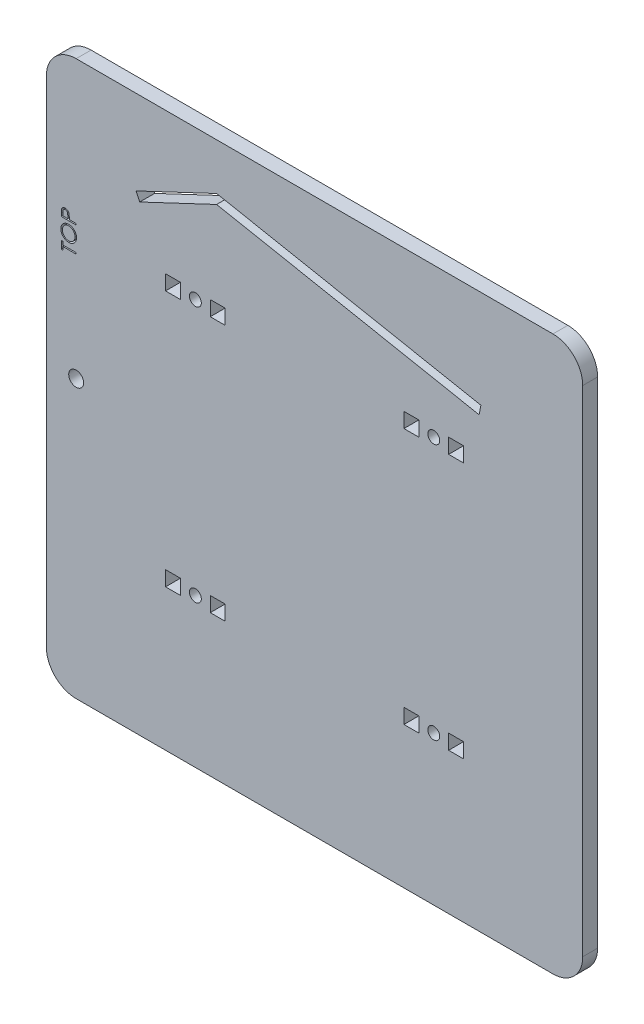
from build123d import *

# Parameters (mm, degrees)
ESQUISSE1_W             = 180
ESQUISSE1_H             = 186
ESQUISSE1_R             = 2.5
ESQUISSE1_R_2           = 2
ESQUISSE1_W_2           = 5
ESQUISSE1_H_2           = 5
BOSS_EXTRU_1_DEPTH      = 5
CONG_1_R                = 10
ENL_V_MAT_EXTRU_1_DEPTH = 259.884143972


with BuildPart() as part:
    # Esquisse1 → Boss.-Extru.1 (new body)
    with BuildSketch(Plane.XY):
        with Locations((90, 93)):
            Rectangle(ESQUISSE1_W, ESQUISSE1_H)
        with Locations((10, 93)):
            Circle(ESQUISSE1_R, mode=Mode.SUBTRACT)
        with Locations((50, 50)):
            Circle(ESQUISSE1_R_2, mode=Mode.SUBTRACT)
        with Locations((50, 136)):
            Circle(ESQUISSE1_R_2, mode=Mode.SUBTRACT)
        with Locations((130, 136)):
            Circle(ESQUISSE1_R_2, mode=Mode.SUBTRACT)
        with Locations((130, 50)):
            Circle(ESQUISSE1_R_2, mode=Mode.SUBTRACT)
        with Locations((42.5, 50)):
            Rectangle(ESQUISSE1_W_2, ESQUISSE1_H_2, mode=Mode.SUBTRACT)
        with Locations((57.5, 50)):
            Rectangle(ESQUISSE1_W_2, ESQUISSE1_H_2, mode=Mode.SUBTRACT)
        with Locations((42.5, 136)):
            Rectangle(ESQUISSE1_W_2, ESQUISSE1_H_2, mode=Mode.SUBTRACT)
        with Locations((57.5, 136)):
            Rectangle(ESQUISSE1_W_2, ESQUISSE1_H_2, mode=Mode.SUBTRACT)
        with Locations((122.5, 136)):
            Rectangle(ESQUISSE1_W_2, ESQUISSE1_H_2, mode=Mode.SUBTRACT)
        with Locations((137.5, 136)):
            Rectangle(ESQUISSE1_W_2, ESQUISSE1_H_2, mode=Mode.SUBTRACT)
        with Locations((122.5, 50)):
            Rectangle(ESQUISSE1_W_2, ESQUISSE1_H_2, mode=Mode.SUBTRACT)
        with Locations((137.5, 50)):
            Rectangle(ESQUISSE1_W_2, ESQUISSE1_H_2, mode=Mode.SUBTRACT)
    extrude(amount=BOSS_EXTRU_1_DEPTH)

    # Congé1
    cong_1_edges = [part.edges().sort_by_distance(p)[0] for p in [
        (0, 0, 2.5),
        (0, 186, 2.5),
        (180, 186, 2.5),
        (180, 0, 2.5),
    ]]
    fillet(cong_1_edges, radius=CONG_1_R)

    # Esquisse2 → Enlèv. mat.-Extru.1 (cut, through all)
    # profile 1 of 4: a face of its own
    with BuildSketch(Plane.XY.offset(5)):
        Polygon((31.334710719, 155.014027844), (57.1419993, 167.198026613), (145.226939688, 150.119771236), (145.821257498, 153.185098913), (57.1419993, 170.37858297), (30.10681248, 157.614875464), align=None)
    # profile 2 of 4: a face of its own
    with BuildSketch(Plane.XY.offset(5)):
        Polygon((5.512820513, 128.08974359), (5, 128.08974359), (5, 130.717948718), (5.512820513, 130.717948718), (5.512820513, 129.628205128), (10, 129.628205128), (10, 129.179487179), (5.512820513, 129.179487179), align=None)
    # profile 3 of 4: a face of its own
    with BuildSketch(Plane.XY.offset(5)):
        with BuildLine():
            add(Edge.make_bspline(
                [(4.871794872, 133.955128205), (4.874100366, 134.047721308), (4.878628546, 134.229581801), (4.914435384, 134.496612547), (4.973369693, 134.75230646), (5.056597521, 134.996810534), (5.164491941, 135.229194861), (5.295552763, 135.450115756), (5.450576468, 135.65891114), (5.627286682, 135.854143791), (5.820813205, 136.032241199), (6.027987018, 136.188522598), (6.2462034, 136.320360707), (6.475473732, 136.428284559), (6.715262732, 136.513011935), (6.966914295, 136.5714636), (7.228780179, 136.608804938), (7.407390098, 136.61317018), (7.497996795, 136.615384615)],
                knots=[0, 0, 0, 0, 1.065064174, 2.09187391, 3.093564831, 4.079973196, 5.057907931, 6.036227367, 7.030399151, 8.044883615, 9.061699972, 10.052012555, 11.025713132, 11.989727027, 12.962874294, 13.945865945, 14.957962116, 16, 16, 16, 16], degree=3))
            add(Edge.make_bspline(
                [(7.497996795, 136.615384615), (7.587935538, 136.613169435), (7.765215219, 136.608803057), (8.025426824, 136.571433302), (8.27553185, 136.512751121), (8.514972844, 136.429333599), (8.743777519, 136.321326931), (8.962159098, 136.189294737), (9.169886274, 136.033309942), (9.364746036, 135.855968827), (9.542997604, 135.662073634), (9.700222429, 135.455696049), (9.832117929, 135.237485486), (9.941246652, 135.00970325), (10.024208322, 134.770560724), (10.084607157, 134.52179815), (10.121577801, 134.262060189), (10.125971778, 134.085124404), (10.128205128, 133.995192308)],
                knots=[0, 0, 0, 0, 1.043748596, 2.057349401, 3.045489418, 4.02252776, 4.995289225, 5.97782527, 6.980224157, 8.006516136, 9.032559198, 10.034193337, 11.013412982, 11.987833483, 12.961212594, 13.946489799, 14.956251404, 16, 16, 16, 16], degree=3))
            add(Edge.make_bspline(
                [(10.128205128, 133.995192308), (10.125991718, 133.904586138), (10.121628499, 133.725977258), (10.084226492, 133.463781493), (10.025738915, 133.211956145), (9.942154006, 132.971221357), (9.834129391, 132.741442886), (9.702408849, 132.52217134), (9.546112933, 132.314286844), (9.368732112, 132.11951292), (9.175629895, 131.94129978), (8.968723816, 131.785929243), (8.752073164, 131.654179081), (8.525076701, 131.546517178), (8.288831783, 131.461282236), (8.041762529, 131.403132495), (7.785277521, 131.365509707), (7.610644809, 131.361174212), (7.522035256, 131.358974359)],
                knots=[0, 0, 0, 0, 1.053102029, 2.075944431, 3.073151272, 4.055350789, 5.033113405, 6.020478099, 7.024410459, 8.052272461, 9.079885166, 10.07527673, 11.055994387, 12.023226415, 12.992069828, 13.970394897, 14.97016774, 16, 16, 16, 16], degree=3))
            add(Edge.make_bspline(
                [(7.522035256, 131.358974359), (7.462560015, 131.359738124), (7.344359838, 131.361256019), (7.168836124, 131.379529865), (6.996135184, 131.406046581), (6.826748116, 131.444049313), (6.661089566, 131.493751695), (6.498017048, 131.552397448), (6.339183157, 131.624025799), (6.183835454, 131.704998153), (6.034395589, 131.795372165), (5.893139041, 131.895194664), (5.758880475, 132.000959476), (5.635099041, 132.116907181), (5.518193817, 132.239216388), (5.409961364, 132.369871214), (5.30942572, 132.508074421), (5.218825233, 132.654420677), (5.136883612, 132.805303927), (5.066566682, 132.960842181), (5.006215165, 133.118922998), (4.957299701, 133.28028678), (4.918682507, 133.444505026), (4.892386287, 133.611936147), (4.874065833, 133.782446756), (4.872555116, 133.897320069), (4.871794872, 133.955128205)],
                knots=[0, 0, 0, 0, 1.037015668, 2.060948919, 3.074880161, 4.083647147, 5.086022904, 6.090072063, 7.104153813, 8.122640571, 9.144368836, 10.147691507, 11.138137339, 12.123020368, 13.103399296, 14.087645067, 15.080126199, 16.082011238, 17.087798457, 18.072939717, 19.057185487, 20.037253025, 21.01195951, 21.997135196, 22.992090687, 24, 24, 24, 24], degree=3))
        make_face()
        with BuildLine():
            add(Edge.make_bspline(
                [(5.384615385, 133.977163462), (5.385191782, 133.929713378), (5.386339066, 133.835266838), (5.4015342, 133.694869329), (5.423036024, 133.556275643), (5.454264212, 133.419753979), (5.494656516, 133.285018024), (5.543372824, 133.15200796), (5.602253781, 133.021179837), (5.668472573, 132.892697094), (5.743686527, 132.769527262), (5.823556399, 132.651373713), (5.91104979, 132.541309721), (6.004274519, 132.437823315), (6.104039635, 132.341171855), (6.209689967, 132.251397972), (6.321682483, 132.168575286), (6.439556284, 132.093700531), (6.562653257, 132.027067843), (6.688620316, 131.967408805), (6.818937839, 131.917953738), (6.952792603, 131.878777957), (7.089594741, 131.845526695), (7.2300896, 131.824669043), (7.373792844, 131.80932419), (7.470910332, 131.808240457), (7.520032051, 131.807692308)],
                knots=[0, 0, 0, 0, 1.008406545, 2.007172654, 2.999155034, 3.989332444, 4.982025741, 5.988181096, 6.998684226, 8.030553839, 9.059268815, 10.065399129, 11.060956322, 12.046057109, 13.024974577, 14.012068307, 14.991706172, 15.984221787, 16.978487447, 17.966117052, 18.945677757, 19.938371053, 20.93015022, 21.936155317, 22.956113857, 24, 24, 24, 24], degree=3))
            add(Edge.make_bspline(
                [(7.520032051, 131.807692308), (7.592262153, 131.809517706), (7.734361108, 131.813108829), (7.942624745, 131.844417334), (8.142969779, 131.893026882), (8.334202078, 131.963501544), (8.517174398, 132.053405882), (8.691174677, 132.163070921), (8.856151586, 132.293500964), (9.010877038, 132.441570897), (9.152044866, 132.603481466), (9.276132129, 132.775324258), (9.38056743, 132.955739717), (9.467872995, 133.143687975), (9.533645375, 133.340773702), (9.580541052, 133.54573326), (9.610935473, 133.75857118), (9.613887494, 133.903607886), (9.615384615, 133.977163462)],
                knots=[0, 0, 0, 0, 1.032022337, 2.030307203, 3.003823408, 3.974715386, 4.937372378, 5.913284036, 6.909147208, 7.938749767, 8.970518239, 9.975863271, 10.963918693, 11.946286286, 12.933361397, 13.927862637, 14.949112547, 16, 16, 16, 16], degree=3))
            add(Edge.make_bspline(
                [(9.615384615, 133.977163462), (9.614705871, 134.026605801), (9.613359718, 134.124664811), (9.599782149, 134.270512706), (9.578052476, 134.413746565), (9.546611683, 134.554101743), (9.507782619, 134.691762134), (9.459619166, 134.826312368), (9.401882729, 134.957707756), (9.337537382, 135.086594397), (9.264442801, 135.210086396), (9.185649647, 135.327523252), (9.099700046, 135.437397621), (9.007727364, 135.540835473), (8.908268925, 135.63680957), (8.803260669, 135.726327848), (8.691030462, 135.807718507), (8.573639443, 135.882339435), (8.451439922, 135.949785143), (8.325126552, 136.007718527), (8.195376793, 136.057194836), (8.062095316, 136.097078346), (7.925581926, 136.128347168), (7.785641242, 136.149888858), (7.642556621, 136.16495834), (7.545779663, 136.166094126), (7.496995192, 136.166666667)],
                knots=[0, 0, 0, 0, 1.047334373, 2.07717862, 3.100662057, 4.115010574, 5.122652213, 6.129548646, 7.140165612, 8.16200981, 9.179904151, 10.178566626, 11.156366481, 12.133321541, 13.108841334, 14.082538371, 15.054589433, 16.043660176, 17.028268541, 18.009491307, 18.985652105, 19.968123554, 20.954864208, 21.950389976, 22.966808393, 24, 24, 24, 24], degree=3))
            add(Edge.make_bspline(
                [(7.496995192, 136.166666667), (7.448544472, 136.166093648), (7.352433543, 136.16495696), (7.21034666, 136.149896282), (7.0714135, 136.128323582), (6.936179497, 136.097233999), (6.804610173, 136.057162352), (6.676829113, 136.007751874), (6.552360233, 135.949487181), (6.43151135, 135.882618212), (6.315547019, 135.807453036), (6.204687986, 135.725317342), (6.101006831, 135.634799377), (6.001978999, 135.538461671), (5.909585252, 135.433988056), (5.824182583, 135.3213603), (5.741923034, 135.203382687), (5.669122422, 135.077387241), (5.601554572, 134.947821857), (5.543908824, 134.81475094), (5.494399292, 134.680074937), (5.454143633, 134.543255388), (5.423155643, 134.404356965), (5.401514958, 134.263460443), (5.386344285, 134.121057631), (5.385193514, 134.025280393), (5.384615385, 133.977163462)],
                knots=[0, 0, 0, 0, 1.029877221, 2.042951179, 3.035109885, 4.018542222, 4.991021277, 5.957494829, 6.929429462, 7.911425532, 8.892163142, 9.866273635, 10.842761649, 11.81676864, 12.802607151, 13.805177466, 14.821356543, 15.858816981, 16.897175917, 17.927346774, 18.940346092, 19.946830556, 20.957962087, 21.964146003, 22.97721996, 24, 24, 24, 24], degree=3))
        make_face(mode=Mode.SUBTRACT)
    # profile 4 of 4: a face of its own
    with BuildSketch(Plane.XY.offset(5)):
        with BuildLine():
            Line((5, 137.641025641), (5, 138.621594551))
            add(Edge.make_bspline(
                [(5, 138.621594551), (5.000074137, 138.689038703), (5.000216188, 138.818264693), (5.004522968, 139.003571915), (5.010275385, 139.171871532), (5.018249518, 139.322800647), (5.027673219, 139.456823645), (5.040890418, 139.573334073), (5.05469084, 139.673247724), (5.068721421, 139.733114081), (5.075120192, 139.760416667)],
                knots=[0, 0, 0, 0, 1.415646017, 2.712440637, 3.8905458, 4.950247383, 5.884950622, 6.709939814, 7.411656543, 8, 8, 8, 8], degree=3))
            add(Edge.make_bspline(
                [(5.075120192, 139.760416667), (5.084580491, 139.794978556), (5.103278168, 139.863287928), (5.140720988, 139.961722351), (5.185143963, 140.05535451), (5.235676091, 140.14460231), (5.294804796, 140.227840245), (5.358596495, 140.307843096), (5.431173681, 140.38178677), (5.510247246, 140.450672822), (5.594814292, 140.514342289), (5.686411295, 140.567836154), (5.782303587, 140.614609524), (5.883794422, 140.652905255), (5.990982335, 140.681383552), (6.103105582, 140.702525818), (6.220290239, 140.716006907), (6.300376841, 140.717293675), (6.341145833, 140.717948718)],
                knots=[0, 0, 0, 0, 0.999549623, 1.97554611, 2.93413192, 3.889860808, 4.833293765, 5.780583482, 6.742559327, 7.719844669, 8.705620613, 9.691528643, 10.674968152, 11.680406189, 12.713313868, 13.765869198, 14.862690416, 16, 16, 16, 16], degree=3))
            add(Edge.make_bspline(
                [(6.341145833, 140.717948718), (6.382256943, 140.717346683), (6.462693606, 140.71616876), (6.580369018, 140.702031209), (6.692823861, 140.682988078), (6.79980879, 140.653706575), (6.900688462, 140.615355614), (6.997004508, 140.570366967), (7.087118325, 140.51610478), (7.171357064, 140.453755024), (7.249799796, 140.384395603), (7.321878074, 140.308319977), (7.387169986, 140.225835274), (7.445821905, 140.137203634), (7.496473733, 140.041560992), (7.541841312, 139.940357916), (7.579942827, 139.832714749), (7.599985772, 139.758225444), (7.610176282, 139.720352564)],
                knots=[0, 0, 0, 0, 1.121902311, 2.195077645, 3.232258892, 4.234102512, 5.217864754, 6.176164875, 7.132989551, 8.084763148, 9.034132444, 9.988522005, 10.94243251, 11.903244335, 12.886203696, 13.894208494, 14.929344452, 16, 16, 16, 16], degree=3))
            add(Edge.make_bspline(
                [(7.610176282, 139.720352564), (7.616832719, 139.689027445), (7.631420688, 139.620376624), (7.647817156, 139.507322681), (7.661264052, 139.375627506), (7.673812802, 139.225739185), (7.680462071, 139.05730818), (7.688269398, 138.870720793), (7.691953248, 138.665345548), (7.692186114, 138.522102718), (7.692307692, 138.447315705)],
                knots=[0, 0, 0, 0, 0.601372724, 1.317943291, 2.144091499, 3.08771165, 4.142394186, 5.309582461, 6.595334295, 8, 8, 8, 8], degree=3))
            Line((7.692307692, 138.447315705), (7.692307692, 138.08974359))
            Line((7.692307692, 138.08974359), (10, 138.08974359))
            Line((10, 138.08974359), (10, 137.641025641))
            Line((10, 137.641025641), (5, 137.641025641))
        make_face()
        with BuildLine():
            Line((5.512820513, 138.08974359), (7.179487179, 138.08974359))
            Line((7.179487179, 138.08974359), (7.190504808, 138.965144231))
            add(Edge.make_bspline(
                [(7.190504808, 138.965144231), (7.190528344, 139.007887281), (7.190573781, 139.090401858), (7.184861269, 139.209592465), (7.178354696, 139.320190727), (7.168513881, 139.421780749), (7.155614132, 139.51471899), (7.139572004, 139.598202692), (7.122131658, 139.673480487), (7.092993168, 139.760073008), (7.048189748, 139.857405854), (6.982968376, 139.963734559), (6.898477204, 140.053149092), (6.803744737, 140.13038218), (6.698642586, 140.19287796), (6.585598045, 140.236966239), (6.466285858, 140.264113982), (6.384692765, 140.267504475), (6.343149038, 140.269230769)],
                knots=[0, 0, 0, 0, 1.160746174, 2.240796558, 3.240300023, 4.169675897, 5.012224395, 5.787635701, 6.478238024, 7.109103438, 8.265591281, 9.382545711, 10.479929969, 11.588830844, 12.694575677, 13.785760505, 14.872603606, 16, 16, 16, 16], degree=3))
            add(Edge.make_bspline(
                [(6.343149038, 140.269230769), (6.302951201, 140.267426971), (6.223042876, 140.263841242), (6.105929782, 140.237190273), (5.9941667, 140.192404533), (5.889910952, 140.130327542), (5.795386935, 140.054968782), (5.713134436, 139.967450026), (5.647453838, 139.867547373), (5.603427941, 139.77538954), (5.577652333, 139.692863335), (5.55903555, 139.621535035), (5.546197995, 139.540585756), (5.533914056, 139.45078464), (5.523998466, 139.352245702), (5.517112701, 139.244342653), (5.513125112, 139.127434819), (5.512924504, 139.046277241), (5.512820513, 139.004206731)],
                knots=[0, 0, 0, 0, 1.120540835, 2.227496496, 3.330685923, 4.466139262, 5.598993257, 6.692710361, 7.80064471, 8.921224235, 9.527843361, 10.209888745, 10.975318552, 11.811557897, 12.738105936, 13.73658638, 14.826690375, 16, 16, 16, 16], degree=3))
            Line((5.512820513, 139.004206731), (5.512820513, 138.08974359))
        make_face(mode=Mode.SUBTRACT)
    extrude(amount=-ENL_V_MAT_EXTRU_1_DEPTH, mode=Mode.SUBTRACT)


with BuildPart() as enl_v_mat_extru_1_piece_1:
    # of the separate pieces the step leaves, piece 1, a body of its own (enl_v_mat_extru_1_pieces)
    add(part.part.solids().sort_by_distance((10, 0, 0))[0])


with BuildPart() as enl_v_mat_extru_1_piece_2:
    # of the separate pieces the step leaves, piece 2, a body of its own (enl_v_mat_extru_1_pieces)
    add(part.part.solids().sort_by_distance((7.520032051, 131.807692308, 0))[0])


with BuildPart() as enl_v_mat_extru_1_piece_3:
    # of the separate pieces the step leaves, piece 3, a body of its own (enl_v_mat_extru_1_pieces)
    add(part.part.solids().sort_by_distance((5.512820513, 139.004206731, 0))[0])


solid = Compound([enl_v_mat_extru_1_piece_1.part, enl_v_mat_extru_1_piece_2.part, enl_v_mat_extru_1_piece_3.part])
